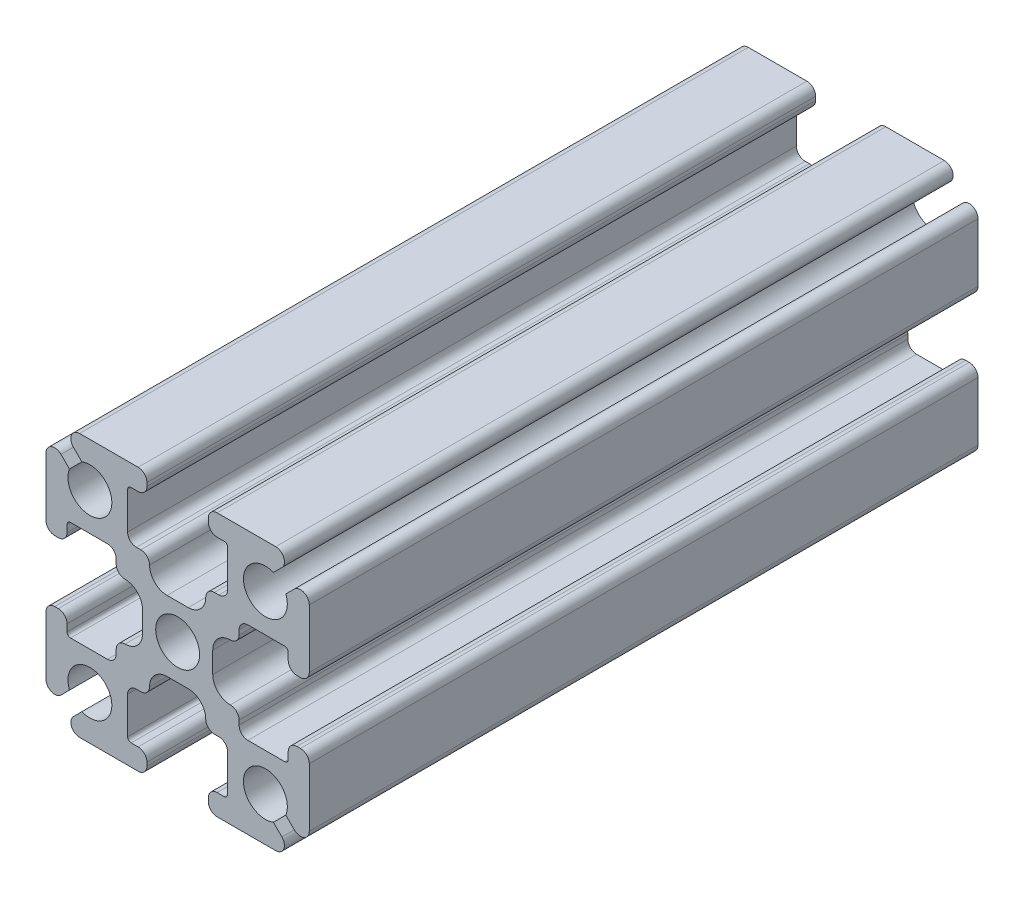
from build123d import *

# Parameters (mm, degrees)
SKETCH1_R           = 1.25
BOSS_EXTRUDE1_DEPTH = 38.1


with BuildPart() as part:
    # Sketch1 → Boss-Extrude1 (new body)
    with BuildSketch(Plane.XY):
        with BuildLine():
            Line((6.646446609, 5.939339828), (6.163645978, 5.456539197))
            ThreePointArc((6.163645978, 5.456539197), (4.116116524, 4.116116524), (5.456539197, 6.163645978))
            Line((5.456539197, 6.163645978), (5.939339828, 6.646446609))
            ThreePointArc((5.939339828, 6.646446609), (6.047726204, 7.191341716), (5.585786438, 7.5))
            Line((5.585786438, 7.5), (2.25, 7.5))
            ThreePointArc((2.25, 7.5), (1.896446609, 7.353553391), (1.75, 7))
            Line((1.75, 7), (1.75, 6.8))
            ThreePointArc((1.75, 6.8), (1.896446609, 6.446446609), (2.25, 6.3))
            Line((2.25, 6.3), (2.65, 6.3))
            ThreePointArc((2.65, 6.3), (2.791421356, 6.241421356), (2.85, 6.1))
            Line((2.85, 6.1), (2.85, 4))
            ThreePointArc((2.85, 4), (2.703553391, 3.646446609), (2.35, 3.5))
            Line((2.35, 3.5), (2.1, 3.5))
            ThreePointArc((2.1, 3.5), (1.746446609, 3.353553391), (1.6, 3))
            ThreePointArc((1.6, 3), (1.307106781, 2.292893219), (0.6, 2))
            Line((0.6, 2), (-0.6, 2))
            ThreePointArc((-0.6, 2), (-1.307106781, 2.292893219), (-1.6, 3))
            ThreePointArc((-1.6, 3), (-1.746446609, 3.353553391), (-2.1, 3.5))
            Line((-2.1, 3.5), (-2.35, 3.5))
            ThreePointArc((-2.35, 3.5), (-2.703553391, 3.646446609), (-2.85, 4))
            Line((-2.85, 4), (-2.85, 6.1))
            ThreePointArc((-2.85, 6.1), (-2.791421356, 6.241421356), (-2.65, 6.3))
            Line((-2.65, 6.3), (-2.25, 6.3))
            ThreePointArc((-2.25, 6.3), (-1.896446609, 6.446446609), (-1.75, 6.8))
            Line((-1.75, 6.8), (-1.75, 7))
            ThreePointArc((-1.75, 7), (-1.896446609, 7.353553391), (-2.25, 7.5))
            Line((-2.25, 7.5), (-5.585786438, 7.5))
            ThreePointArc((-5.585786438, 7.5), (-6.047726204, 7.191341716), (-5.939339828, 6.646446609))
            Line((-5.939339828, 6.646446609), (-5.456539197, 6.163645978))
            ThreePointArc((-5.456539197, 6.163645978), (-4.116116524, 4.116116524), (-6.163645978, 5.456539197))
            Line((-6.163645978, 5.456539197), (-6.646446609, 5.939339828))
            ThreePointArc((-6.646446609, 5.939339828), (-7.191341716, 6.047726204), (-7.5, 5.585786438))
            Line((-7.5, 5.585786438), (-7.5, 2.25))
            ThreePointArc((-7.5, 2.25), (-7.353553391, 1.896446609), (-7, 1.75))
            Line((-7, 1.75), (-6.8, 1.75))
            ThreePointArc((-6.8, 1.75), (-6.446446609, 1.896446609), (-6.3, 2.25))
            Line((-6.3, 2.25), (-6.3, 2.65))
            ThreePointArc((-6.3, 2.65), (-6.241421356, 2.791421356), (-6.1, 2.85))
            Line((-6.1, 2.85), (-4, 2.85))
            ThreePointArc((-4, 2.85), (-3.646446609, 2.703553391), (-3.5, 2.35))
            Line((-3.5, 2.35), (-3.5, 2.1))
            ThreePointArc((-3.5, 2.1), (-3.353553391, 1.746446609), (-3, 1.6))
            ThreePointArc((-3, 1.6), (-2.292893219, 1.307106781), (-2, 0.6))
            Line((-2, 0.6), (-2, -0.6))
            ThreePointArc((-2, -0.6), (-2.292893219, -1.307106781), (-3, -1.6))
            ThreePointArc((-3, -1.6), (-3.353553391, -1.746446609), (-3.5, -2.1))
            Line((-3.5, -2.1), (-3.5, -2.35))
            ThreePointArc((-3.5, -2.35), (-3.646446609, -2.703553391), (-4, -2.85))
            Line((-4, -2.85), (-6.1, -2.85))
            ThreePointArc((-6.1, -2.85), (-6.241421356, -2.791421356), (-6.3, -2.65))
            Line((-6.3, -2.65), (-6.3, -2.25))
            ThreePointArc((-6.3, -2.25), (-6.446446609, -1.896446609), (-6.8, -1.75))
            Line((-6.8, -1.75), (-7, -1.75))
            ThreePointArc((-7, -1.75), (-7.353553391, -1.896446609), (-7.5, -2.25))
            Line((-7.5, -2.25), (-7.5, -5.585786438))
            ThreePointArc((-7.5, -5.585786438), (-7.191341716, -6.047726204), (-6.646446609, -5.939339828))
            Line((-6.646446609, -5.939339828), (-6.163645978, -5.456539197))
            ThreePointArc((-6.163645978, -5.456539197), (-4.116116524, -4.116116524), (-5.456539197, -6.163645978))
            Line((-5.456539197, -6.163645978), (-5.939339828, -6.646446609))
            ThreePointArc((-5.939339828, -6.646446609), (-6.047726204, -7.191341716), (-5.585786438, -7.5))
            Line((-5.585786438, -7.5), (-2.25, -7.5))
            ThreePointArc((-2.25, -7.5), (-1.896446609, -7.353553391), (-1.75, -7))
            Line((-1.75, -7), (-1.75, -6.8))
            ThreePointArc((-1.75, -6.8), (-1.896446609, -6.446446609), (-2.25, -6.3))
            Line((-2.25, -6.3), (-2.65, -6.3))
            ThreePointArc((-2.65, -6.3), (-2.791421356, -6.241421356), (-2.85, -6.1))
            Line((-2.85, -6.1), (-2.85, -4))
            ThreePointArc((-2.85, -4), (-2.703553391, -3.646446609), (-2.35, -3.5))
            Line((-2.35, -3.5), (-2.1, -3.5))
            ThreePointArc((-2.1, -3.5), (-1.746446609, -3.353553391), (-1.6, -3))
            ThreePointArc((-1.6, -3), (-1.307106781, -2.292893219), (-0.6, -2))
            Line((-0.6, -2), (0.6, -2))
            ThreePointArc((0.6, -2), (1.307106781, -2.292893219), (1.6, -3))
            ThreePointArc((1.6, -3), (1.746446609, -3.353553391), (2.1, -3.5))
            Line((2.1, -3.5), (2.35, -3.5))
            ThreePointArc((2.35, -3.5), (2.703553391, -3.646446609), (2.85, -4))
            Line((2.85, -4), (2.85, -6.1))
            ThreePointArc((2.85, -6.1), (2.791421356, -6.241421356), (2.65, -6.3))
            Line((2.65, -6.3), (2.25, -6.3))
            ThreePointArc((2.25, -6.3), (1.896446609, -6.446446609), (1.75, -6.8))
            Line((1.75, -6.8), (1.75, -7))
            ThreePointArc((1.75, -7), (1.896446609, -7.353553391), (2.25, -7.5))
            Line((2.25, -7.5), (5.585786438, -7.5))
            ThreePointArc((5.585786438, -7.5), (6.047726204, -7.191341716), (5.939339828, -6.646446609))
            Line((5.939339828, -6.646446609), (5.456539197, -6.163645978))
            ThreePointArc((5.456539197, -6.163645978), (4.116116524, -4.116116524), (6.163645978, -5.456539197))
            Line((6.163645978, -5.456539197), (6.646446609, -5.939339828))
            ThreePointArc((6.646446609, -5.939339828), (7.191341716, -6.047726204), (7.5, -5.585786438))
            Line((7.5, -5.585786438), (7.5, -2.25))
            ThreePointArc((7.5, -2.25), (7.353553391, -1.896446609), (7, -1.75))
            Line((7, -1.75), (6.8, -1.75))
            ThreePointArc((6.8, -1.75), (6.446446609, -1.896446609), (6.3, -2.25))
            Line((6.3, -2.25), (6.3, -2.65))
            ThreePointArc((6.3, -2.65), (6.241421356, -2.791421356), (6.1, -2.85))
            Line((6.1, -2.85), (4, -2.85))
            ThreePointArc((4, -2.85), (3.646446609, -2.703553391), (3.5, -2.35))
            Line((3.5, -2.35), (3.5, -2.1))
            ThreePointArc((3.5, -2.1), (3.353553391, -1.746446609), (3, -1.6))
            ThreePointArc((3, -1.6), (2.292893219, -1.307106781), (2, -0.6))
            Line((2, -0.6), (2, 0.6))
            ThreePointArc((2, 0.6), (2.292893219, 1.307106781), (3, 1.6))
            ThreePointArc((3, 1.6), (3.353553391, 1.746446609), (3.5, 2.1))
            Line((3.5, 2.1), (3.5, 2.35))
            ThreePointArc((3.5, 2.35), (3.646446609, 2.703553391), (4, 2.85))
            Line((4, 2.85), (6.1, 2.85))
            ThreePointArc((6.1, 2.85), (6.241421356, 2.791421356), (6.3, 2.65))
            Line((6.3, 2.65), (6.3, 2.25))
            ThreePointArc((6.3, 2.25), (6.446446609, 1.896446609), (6.8, 1.75))
            Line((6.8, 1.75), (7, 1.75))
            ThreePointArc((7, 1.75), (7.353553391, 1.896446609), (7.5, 2.25))
            Line((7.5, 2.25), (7.5, 5.585786438))
            ThreePointArc((7.5, 5.585786438), (7.191341716, 6.047726204), (6.646446609, 5.939339828))
        make_face()
        with Locations(Location((0, 0, 0), (0, 0, 180))):
            Circle(SKETCH1_R, mode=Mode.SUBTRACT)
    extrude(amount=BOSS_EXTRUDE1_DEPTH)


solid = part.part
